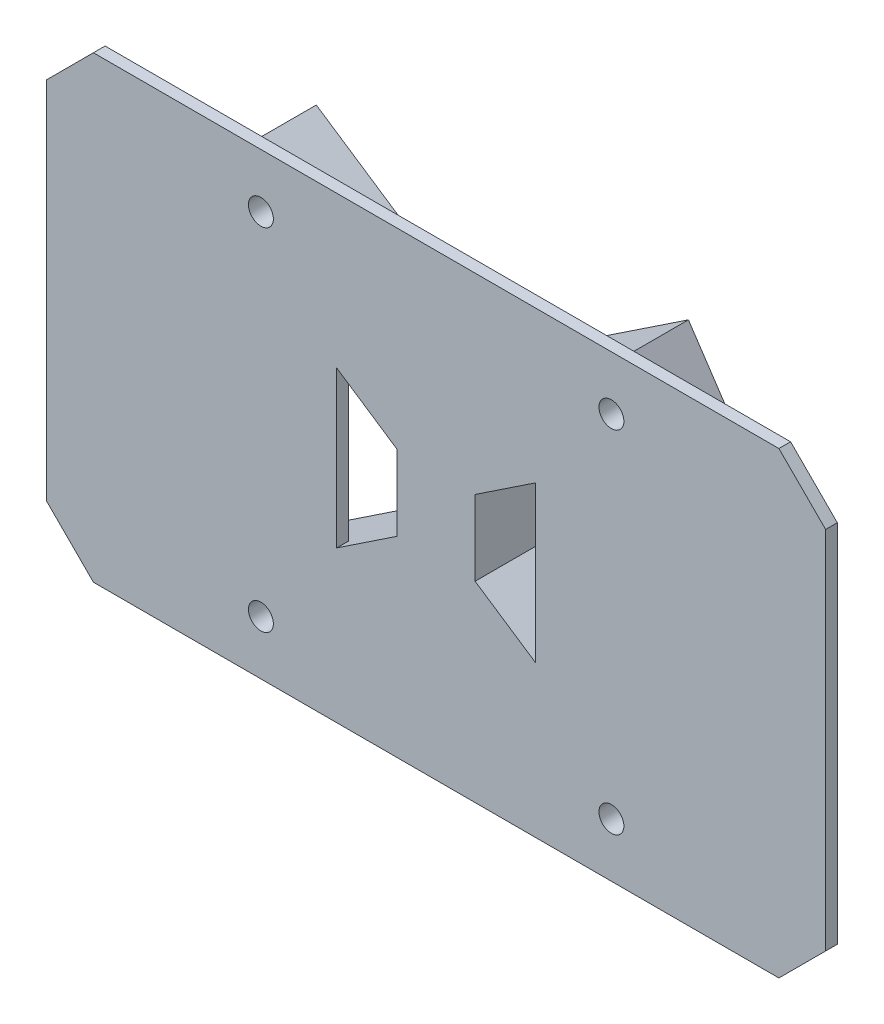
from build123d import *

# Parameters (mm, degrees)
SKETCH1_R           = 1.6
BOSS_EXTRUDE1_DEPTH = 7
SKETCH2_W           = 100
SKETCH2_H           = 58.867504906
SKETCH2_R           = 1.6
BOSS_EXTRUDE2_DEPTH = 1.5
CHAMFER1_SIZE       = 6
CHAMFER2_SIZE       = 6


with BuildPart() as part:
    # Sketch1 → Boss-Extrude1 (new body)
    with BuildSketch(Plane.XY):
        Polygon((-21.113249509, 15.566247547), (-5, 4.824081208), (-5, -4.824081208), (-21.113249509, -15.566247547), (-25.273500981, -18.339748528), (-29.433752453, -21.113249509), (-23.886750491, -29.433752453), (-19.726499019, -26.660251472), (-15.566247547, -23.886750491), (0, -13.509252126), (15.566247547, -23.886750491), (19.726499019, -26.660251472), (23.886750491, -29.433752453), (29.433752453, -21.113249509), (25.273500981, -18.339748528), (21.113249509, -15.566247547), (5, -4.824081208), (5, 4.824081208), (21.113249509, 15.566247547), (25.273500981, 18.339748528), (29.433752453, 21.113249509), (23.886750491, 29.433752453), (19.726499019, 26.660251472), (15.566247547, 23.886750491), (0, 13.509252126), (-15.566247547, 23.886750491), (-19.726499019, 26.660251472), (-23.886750491, 29.433752453), (-29.433752453, 21.113249509), (-25.273500981, 18.339748528), align=None)
        with Locations((-22.5, -22.5)):
            Circle(SKETCH1_R, mode=Mode.SUBTRACT)
        with Locations((22.5, -22.5)):
            Circle(SKETCH1_R, mode=Mode.SUBTRACT)
        with Locations((-22.5, 22.5)):
            Circle(SKETCH1_R, mode=Mode.SUBTRACT)
        with Locations((22.5, 22.5)):
            Circle(SKETCH1_R, mode=Mode.SUBTRACT)
    extrude(amount=BOSS_EXTRUDE1_DEPTH)

    # Sketch2 → Boss-Extrude2 (add)
    with BuildSketch(Plane.XY.offset(7)):
        Rectangle(SKETCH2_W, SKETCH2_H)
        Polygon((-12.763878189, -10), (-12.763878189, 10), (-5, 4.824081208), (-5, -4.824081208), align=None, mode=Mode.SUBTRACT)
        Polygon((12.763878189, 10), (12.763878189, -10), (5, -4.824081208), (5, 4.824081208), align=None, mode=Mode.SUBTRACT)
        with Locations((-22.5, 22.5)):
            Circle(SKETCH2_R, mode=Mode.SUBTRACT)
        with Locations((22.5, 22.5)):
            Circle(SKETCH2_R, mode=Mode.SUBTRACT)
        with Locations((22.5, -22.5)):
            Circle(SKETCH2_R, mode=Mode.SUBTRACT)
        with Locations((-22.5, -22.5)):
            Circle(SKETCH2_R, mode=Mode.SUBTRACT)
    extrude(amount=BOSS_EXTRUDE2_DEPTH)

    # Chamfer1
    chamfer1_edges = [part.edges().sort_by_distance(p)[0] for p in [
        (-50, -29.433752453, 7.75),
    ]]
    chamfer(chamfer1_edges, length=CHAMFER1_SIZE)

    # Chamfer2
    chamfer2_edges = [part.edges().sort_by_distance(p)[0] for p in [
        (50, 29.433752453, 7.75),
        (-50, 29.433752453, 7.75),
        (50, -29.433752453, 7.75),
    ]]
    chamfer(chamfer2_edges, length=CHAMFER2_SIZE)


solid = part.part
